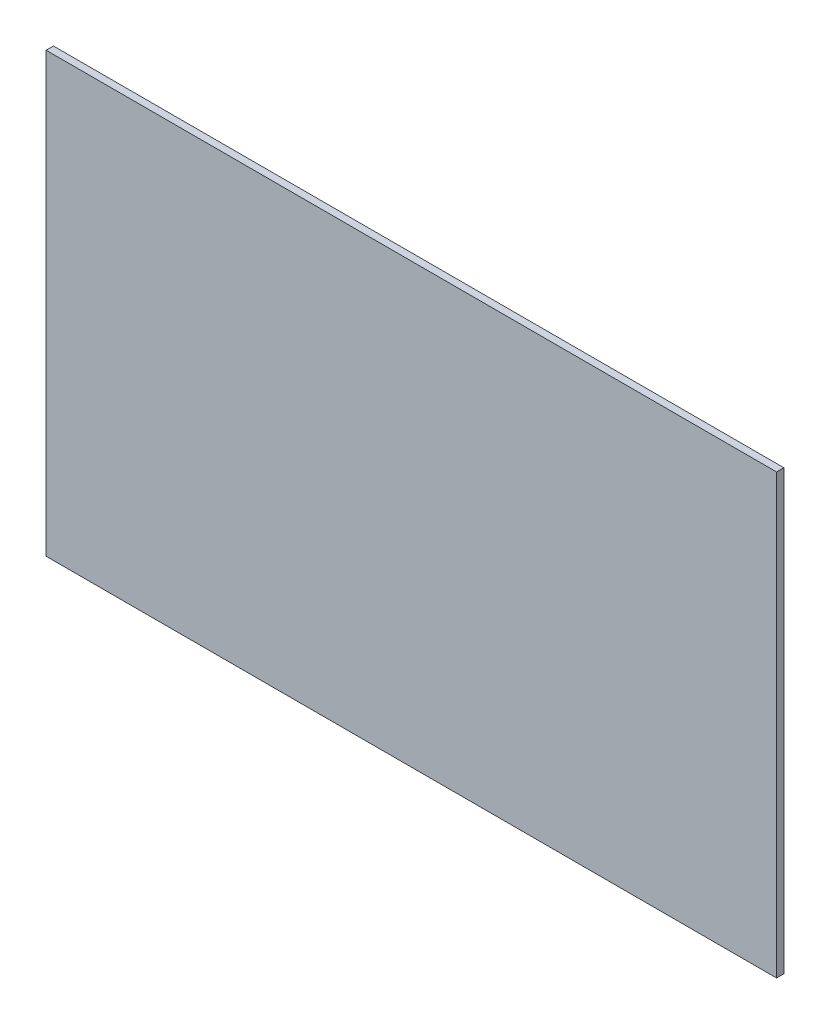
from build123d import *

# Parameters (mm, degrees)
ESQUISSE1_W        = 500
ESQUISSE1_H        = 300
BOSS_EXTRU_1_DEPTH = 5


with BuildPart() as part:
    # Esquisse1 → Boss.-Extru.1 (new body)
    with BuildSketch(Plane.XY):
        Rectangle(ESQUISSE1_W, ESQUISSE1_H)
    extrude(amount=BOSS_EXTRU_1_DEPTH)


solid = part.part
